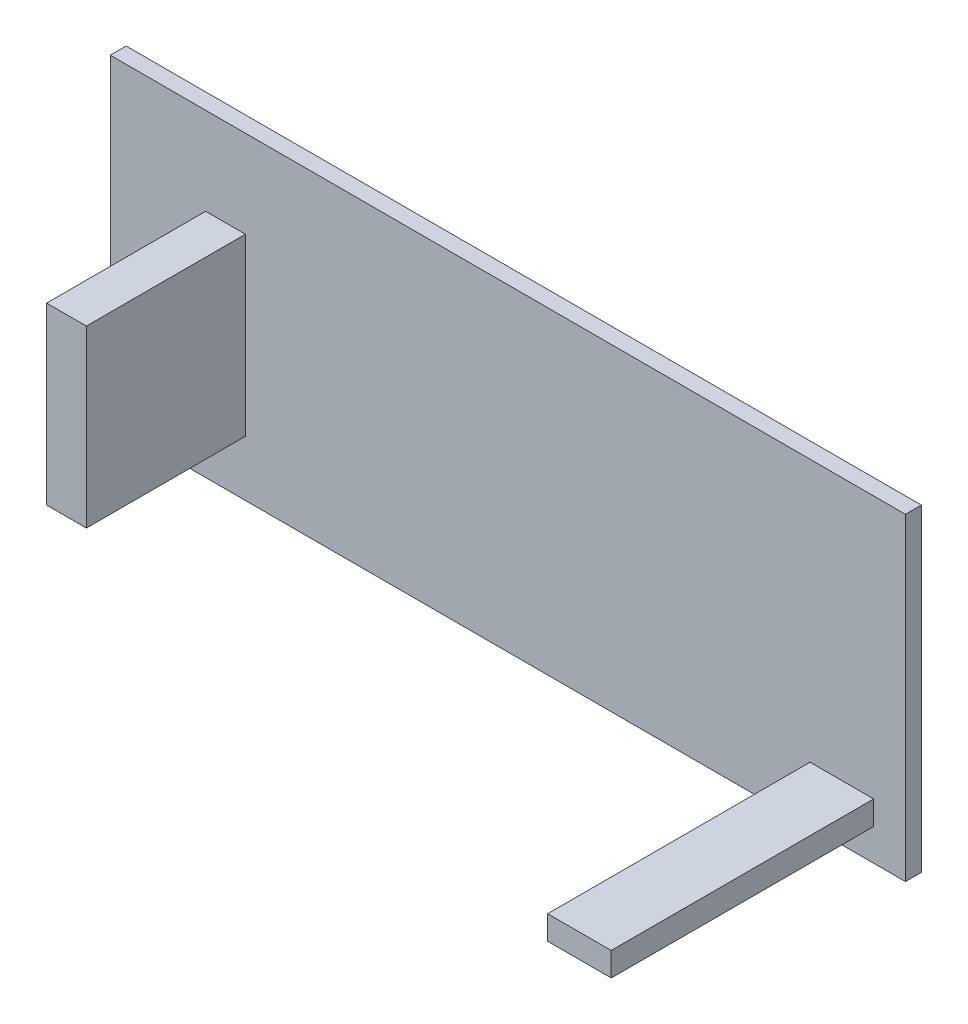
from build123d import *

# Parameters (mm, degrees)
ESQUISSE1_W        = 100
ESQUISSE1_H        = 40
BOSS_EXTRU_1_DEPTH = 2
ESQUISSE3_W        = 5
ESQUISSE3_H        = 22
BOSS_EXTRU_2_DEPTH = 20
ESQUISSE4_W        = 8
ESQUISSE4_H        = 3
BOSS_EXTRU_3_DEPTH = 35


with BuildPart() as part:
    # Esquisse1 → Boss.-Extru.1 (new body)
    with BuildSketch(Plane.XY):
        Rectangle(ESQUISSE1_W, ESQUISSE1_H)
    extrude(amount=BOSS_EXTRU_1_DEPTH)

    # Esquisse3 → Boss.-Extru.2 (add)
    with BuildSketch(Plane.XY.offset(2)):
        with Locations((-35.5, -2)):
            Rectangle(ESQUISSE3_W, ESQUISSE3_H)
    extrude(amount=BOSS_EXTRU_2_DEPTH)

    # Esquisse4 → Boss.-Extru.3 (add)
    with BuildSketch(Plane.XY):
        with Locations((42, -14.5)):
            Rectangle(ESQUISSE4_W, ESQUISSE4_H)
    extrude(amount=BOSS_EXTRU_3_DEPTH)


solid = part.part
